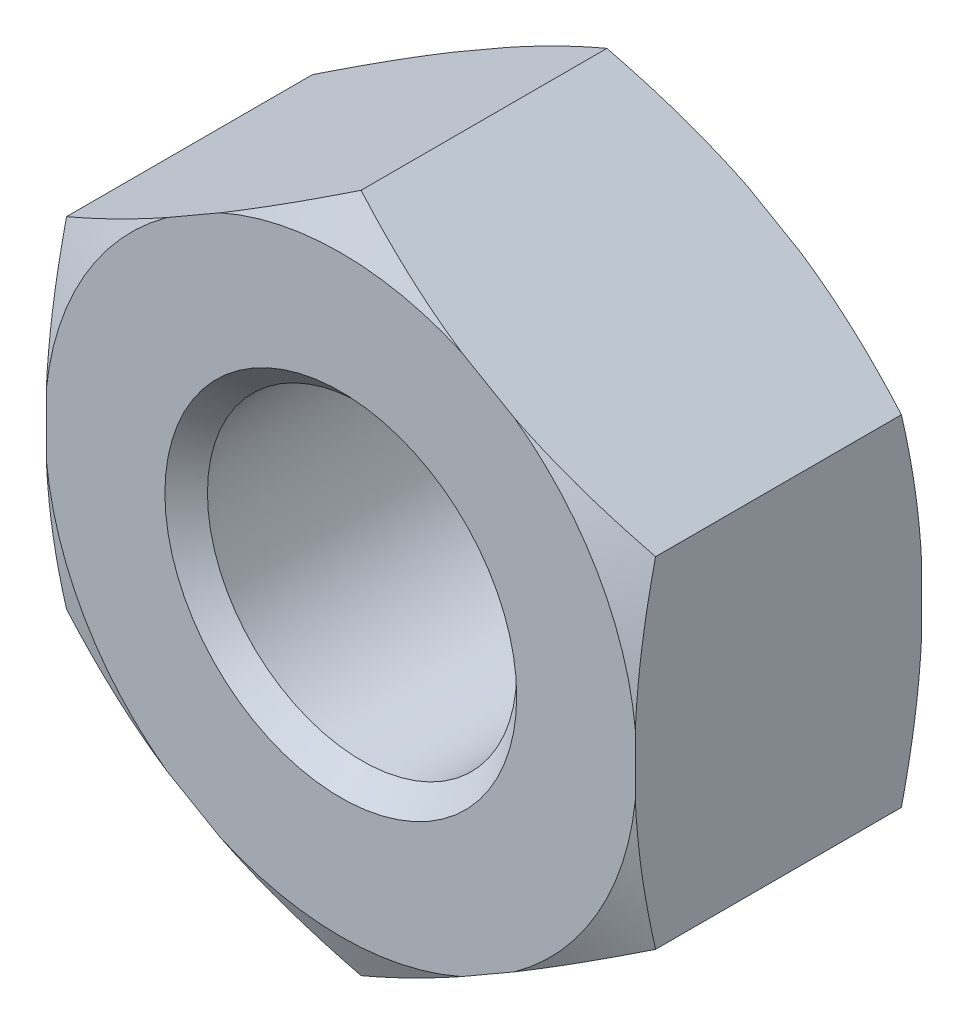
from build123d import *

# Parameters (mm, degrees)
SKETCH_1_R      = 2.1
EXTRUDE_1_DEPTH = 3.89


with BuildPart() as part:
    # 스케치1 → 보스-돌출1 (new body)
    with BuildSketch(Plane.XY):
        Polygon((0, 4.618802154), (-4, 2.309401077), (-4, -2.309401077), (0, -4.618802154), (4, -2.309401077), (4, 2.309401077), align=None)
        Circle(SKETCH_1_R, mode=Mode.SUBTRACT)
    extrude(amount=EXTRUDE_1_DEPTH)

    # 스케치3 → 컷-회전3 (revolve, cut)
    with BuildSketch(Plane(origin=(0, 0, 0), x_dir=(1, 0, 0), z_dir=(0, 1, 0)), mode=Mode.PRIVATE) as cut_revolve_3_sk:
        Polygon((2.09, 0.001), (2.09, -0.299), (2.39, 0.001), align=None)
        Polygon((4, 0.01), (4.65, 0.01), (4.65, -0.29), align=None)
        Polygon((4.65, -3.6), (4, -3.9), (4.65, -3.9), align=None)
        Polygon((2.39, -3.891), (2.09, -3.891), (2.09, -3.591), align=None)
    revolve(cut_revolve_3_sk.sketch.rotate(Axis((0, 0, 1.945), (0, 0, -1)), 180), axis=Axis((0, 0, 1.945), (0, 0, -1)), mode=Mode.SUBTRACT)


solid = part.part
